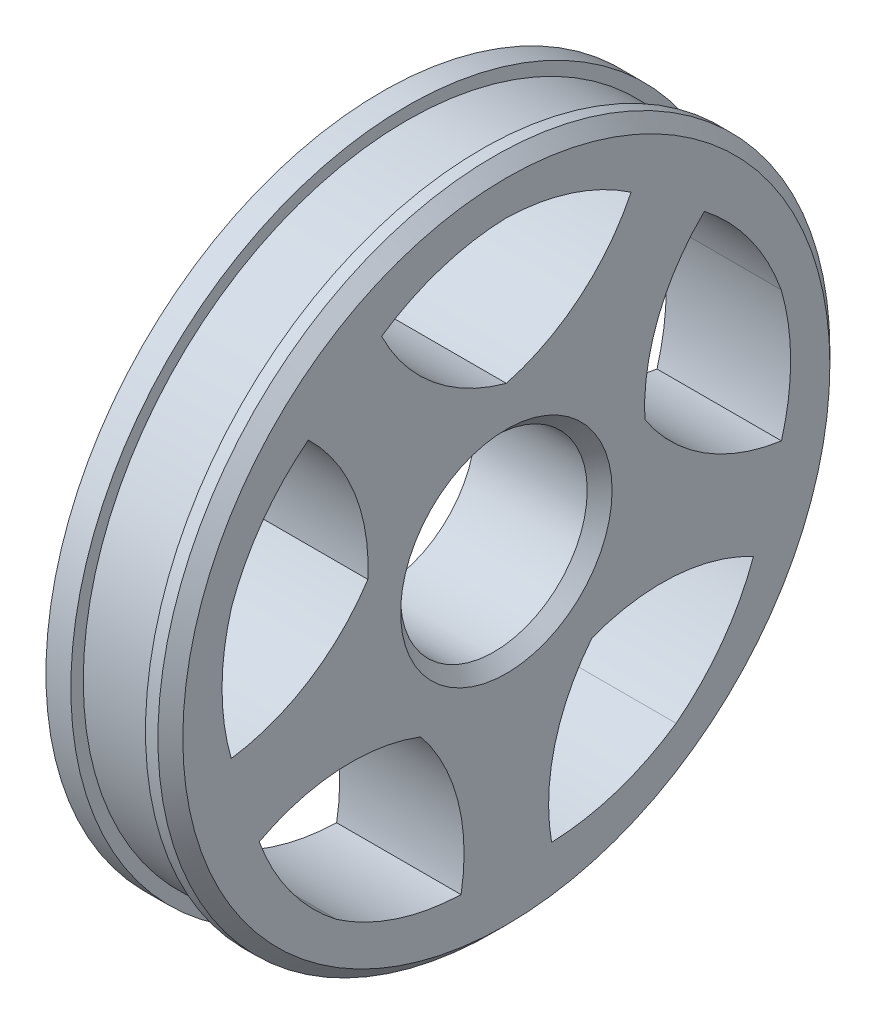
from build123d import *

# Parameters (mm, degrees)
SKETCH1_R           = 13.5
SKETCH1_R_2         = 3.75
BOSS_EXTRUDE1_DEPTH = 2.5
CUT_EXTRUDE1_DEPTH  = 20.254869514
CIRPATTERN1_COUNT   = 5
CHAMFER1_SIZE       = 0.5
SKETCH4_R           = 13.5
SKETCH4_R_2         = 13
CUT_EXTRUDE3_DEPTH  = 1.5


with BuildPart() as part:
    # Sketch1 → Boss-Extrude1 (new, symmetric)
    with BuildSketch(Plane(origin=(0, 0, 0), x_dir=(0, 0, -1), z_dir=(1, 0, 0))):
        Circle(SKETCH1_R)
        Circle(SKETCH1_R_2, mode=Mode.SUBTRACT)
    extrude(amount=BOSS_EXTRUDE1_DEPTH, both=True)

    # Sketch2 → Cut-Extrude1 (cut, symmetric)
    with BuildSketch(Plane(origin=(0, 0, 0), x_dir=(0, 0, -1), z_dir=(1, 0, 0))):
        with BuildLine():
            ThreePointArc((0, 5.849695328), (-2.956289657, 7.377375059), (-5.012219469, 9.99397715))
            ThreePointArc((-5.012219469, 9.99397715), (-2.621563936, 11.159720287), (0, 11.6087119))
            ThreePointArc((0, 11.6087119), (2.621563936, 11.159720287), (5.012219469, 9.99397715))
            ThreePointArc((5.012219469, 9.99397715), (2.956289657, 7.377375059), (0, 5.849695328))
        make_face()
    cut_extrude1 = extrude(amount=CUT_EXTRUDE1_DEPTH, both=True, mode=Mode.SUBTRACT)

    # CirPattern1: Cut-Extrude1 ×5 about axis
    cirpattern1_axis = Axis((0, 0, 0), (1, 0, 0))
    for i in range(1, CIRPATTERN1_COUNT):
        add(cut_extrude1.rotate(cirpattern1_axis, i * 360 / CIRPATTERN1_COUNT), mode=Mode.SUBTRACT)

    # Chamfer1
    chamfer1_edges = [part.edges().sort_by_distance(p)[0] for p in [
        (2.5, 0, 13.5),
        (2.5, 0, 3.75),
    ]]
    chamfer(chamfer1_edges, length=CHAMFER1_SIZE)

    # Sketch4 → Cut-Extrude3 (cut, symmetric)
    with BuildSketch(Plane(origin=(0, 0, 0), x_dir=(0, 0, -1), z_dir=(1, 0, 0))):
        Circle(SKETCH4_R)
        Circle(SKETCH4_R_2, mode=Mode.SUBTRACT)
    extrude(amount=CUT_EXTRUDE3_DEPTH, both=True, mode=Mode.SUBTRACT)


solid = part.part
